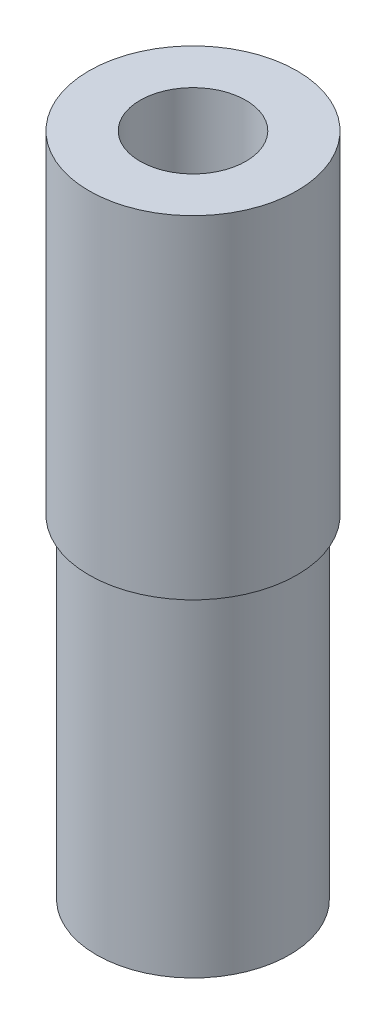
from build123d import *

# Parameters (mm, degrees)
F_10_32_TAPPED_HOLE1_D     = 4.0386
F_10_32_TAPPED_HOLE1_DEPTH = 12.7
F_10_32_TAPPED_HOLE1_TIP   = 1.213317848
F_10_24_TAPPED_HOLE1_D     = 3.7973
F_10_24_TAPPED_HOLE1_DEPTH = 15.24
F_10_24_TAPPED_HOLE1_TIP   = 1.140824014


with BuildPart() as part:
    # Sketch1 → Revolve1 (revolve)
    with BuildSketch(Plane.XY, mode=Mode.PRIVATE) as revolve1_sk:
        Polygon((0, 0), (3.683, 0), (3.683, 12.7), (3.96875, 12.7), (3.96875, 25.4), (0, 25.4), align=None)
    revolve(revolve1_sk.sketch.rotate(Axis((0, 0, 0), (0, 1, 0)), 90), axis=Axis((0, 0, 0), (0, 1, 0)))

    # #10-32 Tapped Hole1
    with Locations(Plane(origin=(0, 25.4, 0), x_dir=(1, 0, 0), z_dir=(0, 1, 0))):
        with Locations((0, 0)):
            Hole(F_10_32_TAPPED_HOLE1_D / 2, depth=F_10_32_TAPPED_HOLE1_DEPTH)
            with Locations((0, 0, -(F_10_32_TAPPED_HOLE1_DEPTH + F_10_32_TAPPED_HOLE1_TIP / 2))):  # 118° drill point
                Cone(0, F_10_32_TAPPED_HOLE1_D / 2, F_10_32_TAPPED_HOLE1_TIP, mode=Mode.SUBTRACT)

    # #10-24 Tapped Hole1
    with Locations(Plane(origin=(0, 0, 0), x_dir=(-1, 0, 0), z_dir=(0, -1, 0))):
        with Locations((0, 0)):
            Hole(F_10_24_TAPPED_HOLE1_D / 2, depth=F_10_24_TAPPED_HOLE1_DEPTH)
            with Locations((0, 0, -(F_10_24_TAPPED_HOLE1_DEPTH + F_10_24_TAPPED_HOLE1_TIP / 2))):  # 118° drill point
                Cone(0, F_10_24_TAPPED_HOLE1_D / 2, F_10_24_TAPPED_HOLE1_TIP, mode=Mode.SUBTRACT)


solid = part.part
